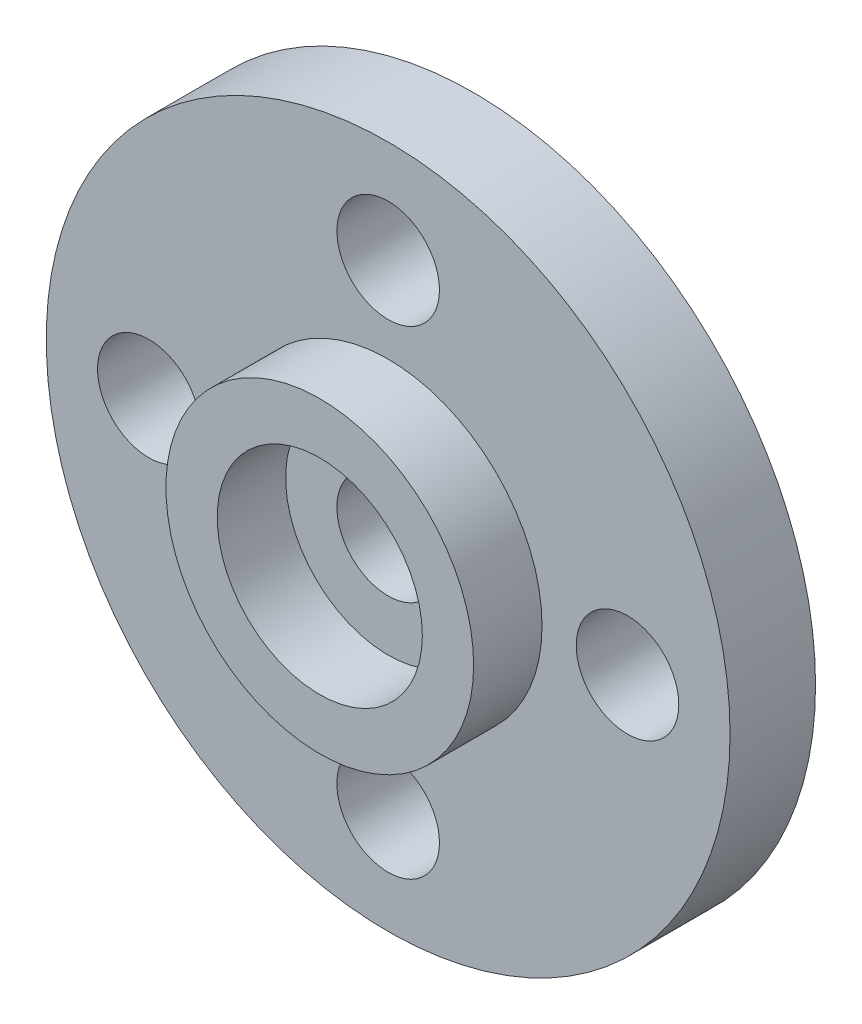
from build123d import *

# Parameters (mm, degrees)
SKETCH_1_R      = 10
SKETCH_1_R_2    = 1.5
EXTRUDE_1_DEPTH = 2.5
SKETCH_2_R      = 4.5
SKETCH_2_R_2    = 3
EXTRUDE_2_DEPTH = 2


with BuildPart() as part:
    # 草图1 → 凸台-拉伸1 (new body)
    with BuildSketch(Plane.XY):
        Circle(SKETCH_1_R)
        Circle(SKETCH_1_R_2, mode=Mode.SUBTRACT)
        with Locations((0, 7)):
            Circle(SKETCH_1_R_2, mode=Mode.SUBTRACT)
        with Locations((-7, 0)):
            Circle(SKETCH_1_R_2, mode=Mode.SUBTRACT)
        with Locations((7, 0)):
            Circle(SKETCH_1_R_2, mode=Mode.SUBTRACT)
        with Locations((0, -7)):
            Circle(SKETCH_1_R_2, mode=Mode.SUBTRACT)
    extrude(amount=EXTRUDE_1_DEPTH)

    # 草图2 → 凸台-拉伸2 (add)
    with BuildSketch(Plane.XY.offset(2.5)):
        Circle(SKETCH_2_R)
        Circle(SKETCH_2_R_2, mode=Mode.SUBTRACT)
    extrude(amount=EXTRUDE_2_DEPTH)


solid = part.part
